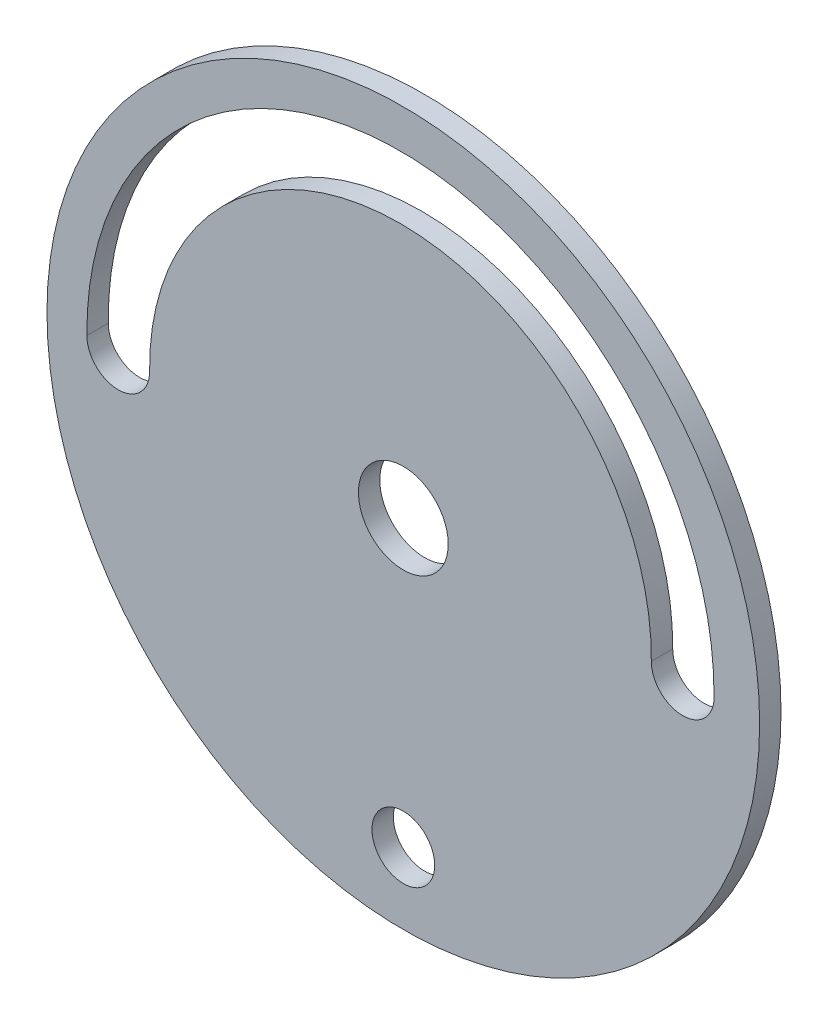
from build123d import *

# Parameters (mm, degrees)
SKETCH1_R           = 25
SKETCH1_R_2         = 2.2
SKETCH1_R_3         = 3.15
BOSS_EXTRUDE1_DEPTH = 1.5


with BuildPart() as part:
    # Sketch1 → Boss-Extrude1 (new body)
    with BuildSketch(Plane.XY):
        with Locations((-2.056478496, 7.394811009)):
            Circle(SKETCH1_R)
        with Locations((-2.056478496, -12.605188991)):
            Circle(SKETCH1_R_2, mode=Mode.SUBTRACT)
        with Locations((-2.056478496, 7.394811009)):
            Circle(SKETCH1_R_3, mode=Mode.SUBTRACT)
        with BuildLine():
            ThreePointArc((19.743521504, 7.394811009), (-2.256478496, 29.594811009), (-24.256478496, 7.394811009))
            ThreePointArc((-24.256478496, 7.394811009), (-22.056478496, 5.194811009), (-19.856478496, 7.394811009))
            ThreePointArc((-19.856478496, 7.394811009), (-2.256478496, 25.194811009), (15.343521504, 7.394811009))
            ThreePointArc((15.343521504, 7.394811009), (17.543521504, 5.194811009), (19.743521504, 7.394811009))
        make_face(mode=Mode.SUBTRACT)
    extrude(amount=BOSS_EXTRUDE1_DEPTH)


solid = part.part
